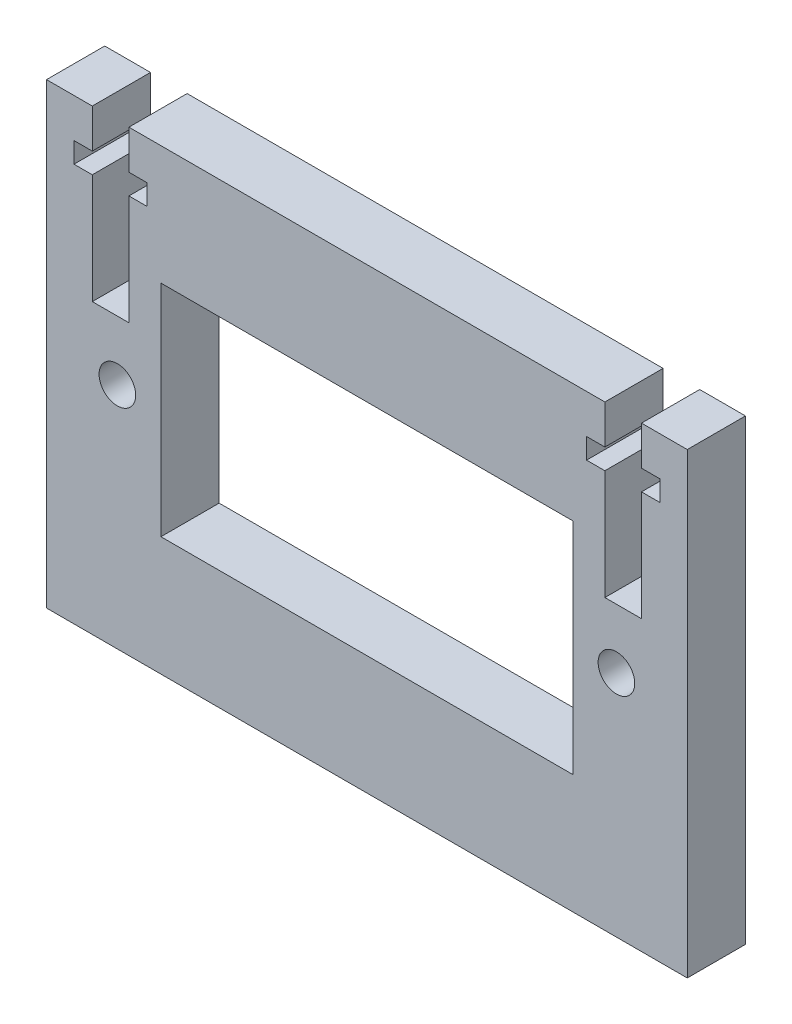
from build123d import *

# Parameters (mm, degrees)
SKETCH1_W           = 35
SKETCH1_H           = 25
BOSS_EXTRUDE1_DEPTH = 3.18
SKETCH2_W           = 22.5
SKETCH2_H           = 12
CUT_EXTRUDE1_DEPTH  = 3.18
SKETCH3_R           = 1
CUT_EXTRUDE2_DEPTH  = 3.18
CUT_EXTRUDE4_DEPTH  = 3.18


with BuildPart() as part:
    # Sketch1 → Boss-Extrude1 (new body)
    with BuildSketch(Plane.XY):
        Rectangle(SKETCH1_W, SKETCH1_H)
    extrude(amount=BOSS_EXTRUDE1_DEPTH)

    # Sketch2 → Cut-Extrude1 (cut)
    with BuildSketch(Plane.XY.offset(3.18)):
        Rectangle(SKETCH2_W, SKETCH2_H)
    extrude(amount=-CUT_EXTRUDE1_DEPTH, mode=Mode.SUBTRACT)

    # Sketch3 → Cut-Extrude2 (cut)
    with BuildSketch(Plane.XY.offset(3.18)):
        with Locations((-13.63, 0)):
            Circle(SKETCH3_R)
    cut_extrude2 = extrude(amount=-CUT_EXTRUDE2_DEPTH, mode=Mode.SUBTRACT)

    # Mirror1: Cut-Extrude2 across plane
    add(cut_extrude2.mirror(Plane(origin=(0, 0, 0), x_dir=(0, 0, 1), z_dir=(1, 0, 0))), mode=Mode.SUBTRACT)

    # Sketch5 → Cut-Extrude4 (cut)
    with BuildSketch(Plane.XY.offset(3.18)):
        Polygon((-13, 12.5), (-15, 12.5), (-15, 10.368), (-16, 10.368), (-16, 9.248), (-15, 9.248), (-15, 3.248), (-13, 3.248), (-13, 9.248), (-12, 9.248), (-12, 10.368), (-13, 10.368), align=None)
    cut_extrude4 = extrude(amount=-CUT_EXTRUDE4_DEPTH, mode=Mode.SUBTRACT)

    # Mirror2: Cut-Extrude4 across plane
    add(cut_extrude4.mirror(Plane(origin=(0, 0, 0), x_dir=(0, 0, 1), z_dir=(1, 0, 0))), mode=Mode.SUBTRACT)


solid = part.part
